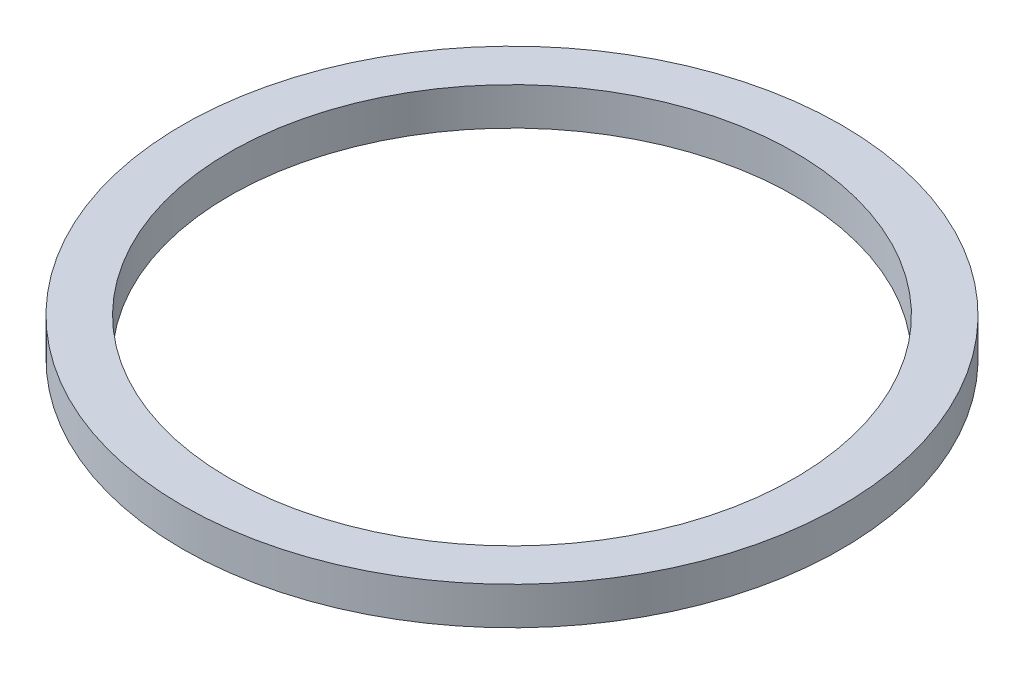
from build123d import *

# Parameters (mm, degrees)
SKETCH_1_R      = 17.5
SKETCH_1_R_2    = 15
EXTRUDE_1_DEPTH = 2


with BuildPart() as part:
    # 草图1 → 凸台-拉伸1 (new body)
    with BuildSketch(Plane(origin=(0, 0, 0), x_dir=(1, 0, 0), z_dir=(0, 1, 0))):
        with Locations(Location((0, 0, 0), (0, 0, 270))):
            Circle(SKETCH_1_R)
        with Locations(Location((0, 0, 0), (0, 0, 270))):
            Circle(SKETCH_1_R_2, mode=Mode.SUBTRACT)
    extrude(amount=EXTRUDE_1_DEPTH)


solid = part.part
